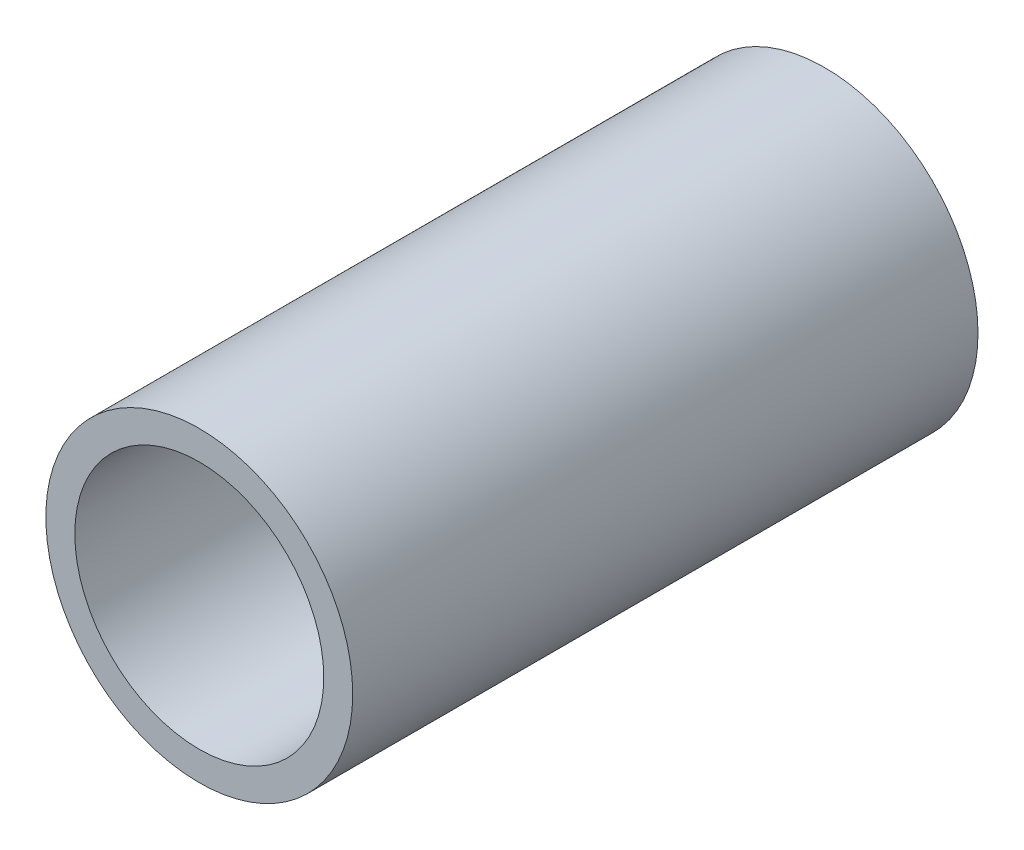
from build123d import *

# Parameters (mm, degrees)
SKETCH1_R           = 26.5
SKETCH1_R_2         = 21.5
BOSS_EXTRUDE1_DEPTH = 108


with BuildPart() as part:
    # Sketch1 → Boss-Extrude1 (new body)
    with BuildSketch(Plane.XY):
        Circle(SKETCH1_R)
        Circle(SKETCH1_R_2, mode=Mode.SUBTRACT)
    extrude(amount=BOSS_EXTRUDE1_DEPTH)


solid = part.part
